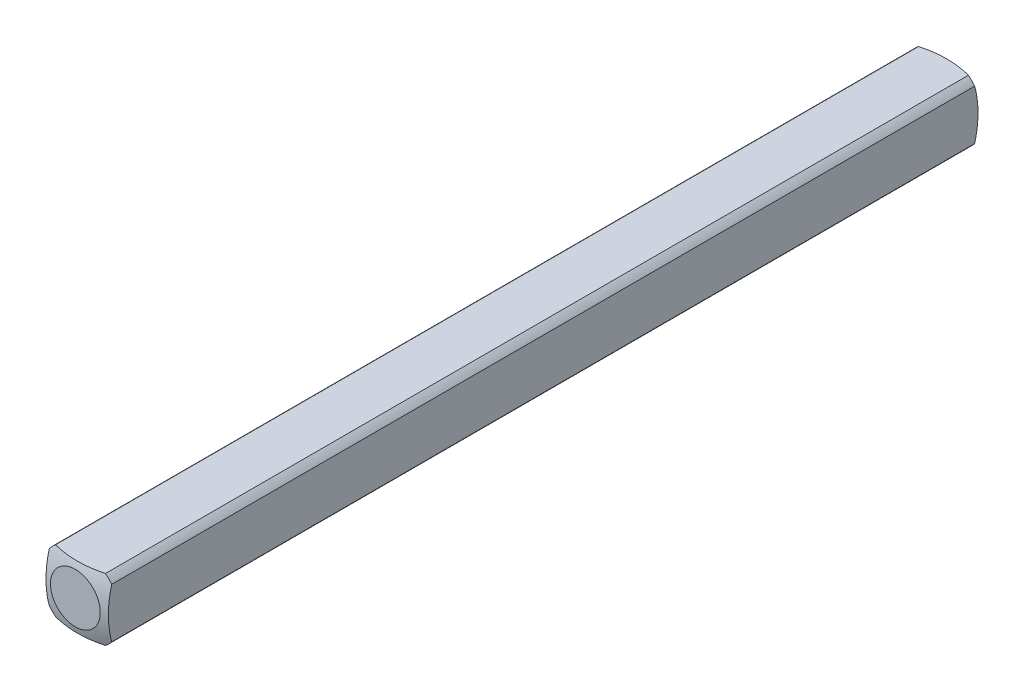
from build123d import *

# Parameters (mm, degrees)
SKETCH1_W           = 3.175
SKETCH1_H           = 3.175
BOSS_EXTRUDE1_DEPTH = 22.225
SKETCH2_OUTSIDE_W   = 9.708
SKETCH2_OUTSIDE_H   = 9.708
SKETCH2_OUTSIDE_R   = 2.032
CUT_EXTRUDE1_DEPTH  = 23.338105056


with BuildPart() as part:
    # Sketch1 → Boss-Extrude1 (new body)
    with BuildSketch(Plane.XY):
        Rectangle(SKETCH1_W, SKETCH1_H)
    extrude(amount=BOSS_EXTRUDE1_DEPTH)

    # Sketch2 outside → Cut-Extrude1 (cut, through all)
    with BuildSketch(Plane(origin=(0, 0, 0), x_dir=(-1, 0, 0), z_dir=(0, 0, -1))):
        Rectangle(SKETCH2_OUTSIDE_W, SKETCH2_OUTSIDE_H)
        Circle(SKETCH2_OUTSIDE_R, mode=Mode.SUBTRACT)
    extrude(amount=-CUT_EXTRUDE1_DEPTH, mode=Mode.SUBTRACT)

    # Sketch3 → Cut-Revolve1 (revolve, cut)
    with BuildSketch(Plane(origin=(0, 0, 0), x_dir=(1, 0, 0), z_dir=(0, 1, 0))):
        with BuildLine():
            Line((-5.053685963, -4.40273269), (-5.053685963, 5.740530545))
            Line((-5.053685963, 5.740530545), (0, 5.740530545))
            Line((0, 5.740530545), (0, 0.160877736))
            ThreePointArc((0, 0.160877736), (-3.404639553, -1.148866368), (-5.053685963, -4.40273269))
        make_face()
    revolve(axis=Axis((0, 0, 22.225), (0, 0, -1)), mode=Mode.SUBTRACT)

    # Mirror1: part across plane


with BuildPart() as part_1:
    add(part.part)
    add(part.part.mirror(Plane(origin=(0, 0, 22.225), x_dir=(1, 0, 0), z_dir=(0, 0, -1))))


solid = part_1.part
